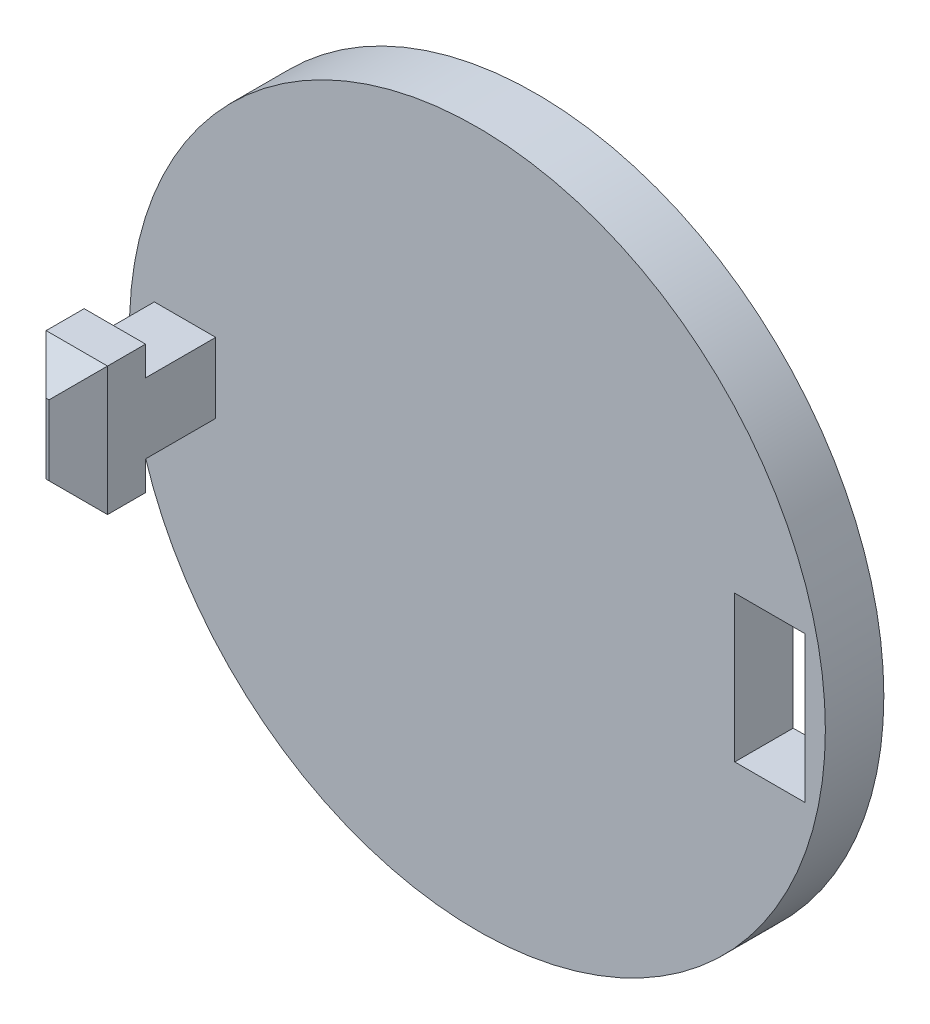
from build123d import *

# Parameters (mm, degrees)
SKETCH1_R           = 11.9
SKETCH1_W           = 2.4
SKETCH1_H           = 5
BOSS_EXTRUDE2_DEPTH = 2
SKETCH2_W           = 2.1
SKETCH2_H           = 2.4
BOSS_EXTRUDE3_DEPTH = 4.7
SKETCH4_W           = 2.1
SKETCH4_H           = 2.3
BOSS_EXTRUDE5_DEPTH = 1
SKETCH5_W           = 2.1
SKETCH5_H           = 2.3
BOSS_EXTRUDE6_DEPTH = 1
CHAMFER1_SIZE       = 1


with BuildPart() as part:
    # Sketch1 → Boss-Extrude2 (new body)
    with BuildSketch(Plane.XY):
        Circle(SKETCH1_R)
        with Locations((10, 0)):
            Rectangle(SKETCH1_W, SKETCH1_H, mode=Mode.SUBTRACT)
    extrude(amount=BOSS_EXTRUDE2_DEPTH)

    # Sketch2 → Boss-Extrude3 (add)
    with BuildSketch(Plane.XY.offset(2)):
        with Locations((-10, 0)):
            Rectangle(SKETCH2_W, SKETCH2_H)
    extrude(amount=BOSS_EXTRUDE3_DEPTH)

    # Sketch4 → Boss-Extrude5 (add)
    with BuildSketch(Plane(origin=(0, 1.2, 0), x_dir=(1, 0, 0), z_dir=(0, 1, 0))):
        with Locations((-10, -5.55)):
            Rectangle(SKETCH4_W, SKETCH4_H)
    extrude(amount=BOSS_EXTRUDE5_DEPTH)

    # Sketch5 → Boss-Extrude6 (add)
    with BuildSketch(Plane.XZ.offset(1.2)):
        with Locations((-10, 5.55)):
            Rectangle(SKETCH5_W, SKETCH5_H)
    extrude(amount=BOSS_EXTRUDE6_DEPTH)

    # Chamfer1
    chamfer1_edges = [part.edges().sort_by_distance(p)[0] for p in [
        (-8.95, 0, 6.7),
        (-11.05, 0, 6.7),
        (-10, 2.2, 6.7),
        (-10, -2.2, 6.7),
    ]]
    chamfer(chamfer1_edges, length=CHAMFER1_SIZE)


solid = part.part
